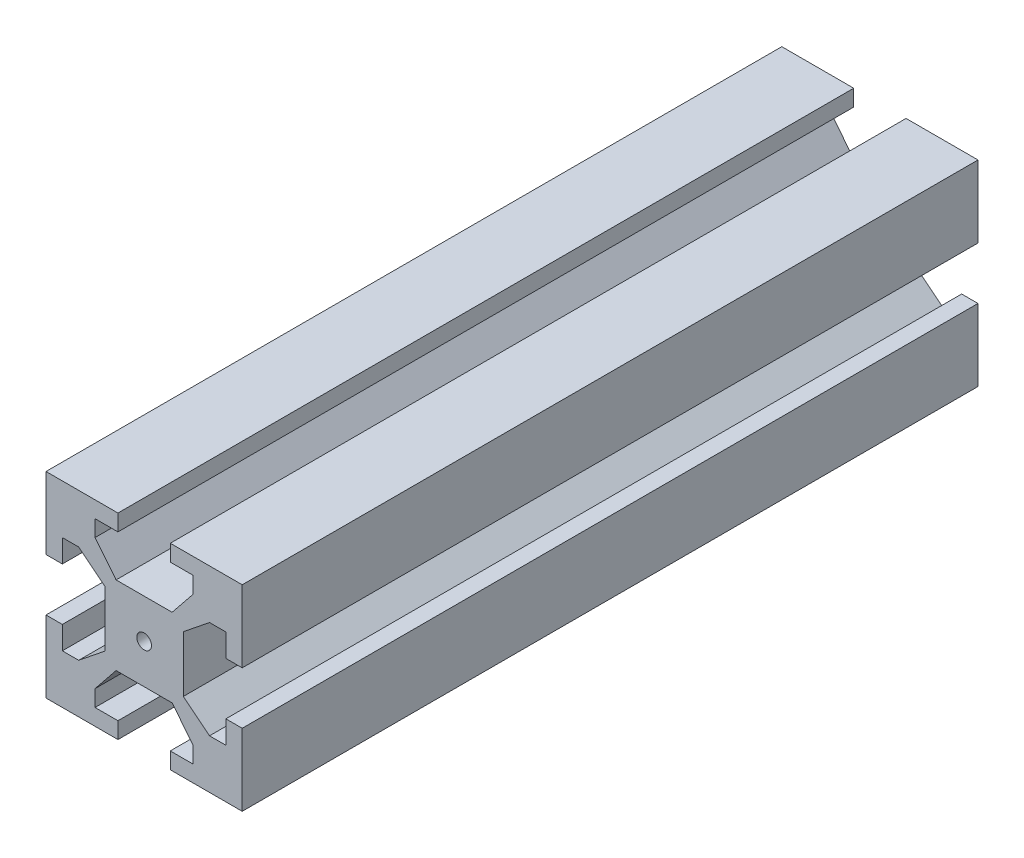
from build123d import *

# Parameters (mm, degrees)
SKETCH1_R           = 1.5
BOSS_EXTRUDE1_DEPTH = 75


with BuildPart() as part:
    # Sketch1 → Boss-Extrude1 (new, symmetric)
    with BuildSketch(Plane.XY):
        Polygon((20, 20), (5.333333333, 20), (5.333333333, 16.666666667), (10, 16.666666667), (10, 13.333333333), (5.714285714, 8), (-5.714285714, 8), (-10, 13.333333333), (-10, 16.666666667), (-5.333333333, 16.666666667), (-5.333333333, 20), (-20, 20), (-20, 5.333333333), (-16.666666667, 5.333333333), (-16.666666667, 10), (-13.333333333, 10), (-8, 5.714285714), (-8, -5.714285714), (-13.333333333, -10), (-16.666666667, -10), (-16.666666667, -5.333333333), (-20, -5.333333333), (-20, -20), (-5.333333333, -20), (-5.333333333, -16.666666667), (-10, -16.666666667), (-10, -13.333333333), (-5.714285714, -8), (5.714285714, -8), (10, -13.333333333), (10, -16.666666667), (5.333333333, -16.666666667), (5.333333333, -20), (20, -20), (20, -5.333333333), (16.666666667, -5.333333333), (16.666666667, -10), (13.333333333, -10), (8, -5.714285714), (8, 5.714285714), (13.333333333, 10), (16.666666667, 10), (16.666666667, 5.333333333), (20, 5.333333333), align=None)
        Circle(SKETCH1_R, mode=Mode.SUBTRACT)
    extrude(amount=BOSS_EXTRUDE1_DEPTH, both=True)


solid = part.part
